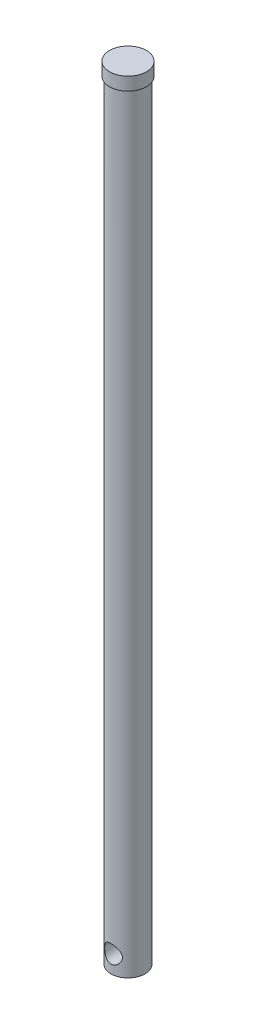
from build123d import *

# Parameters (mm, degrees)
SKETCH1_R                  = 4.953
BOSS_EXTRUDE1_DEPTH        = 228.6
BOSS_EXTRUDE2_START        = -3.81
SKETCH2_R                  = 5.3975
SKETCH2_R_2                = 4.953
BOSS_EXTRUDE2_DEPTH        = 3.81
F_6_0_204_DIAMETER_HOLE1_D = 5.1816


with BuildPart() as part:
    # Sketch1 → Boss-Extrude1 (new body)
    with BuildSketch(Plane(origin=(0, 0, 0), x_dir=(1, 0, 0), z_dir=(0, 1, 0))):
        with Locations(Location((0, 0, 0), (0, 0, 270))):
            Circle(SKETCH1_R)
    extrude(amount=BOSS_EXTRUDE1_DEPTH)

    # Sketch2 → Boss-Extrude2 (add)
    with BuildSketch(Plane(origin=(0, 228.6, 0), x_dir=(1, 0, 0), z_dir=(0, 1, 0)).offset(BOSS_EXTRUDE2_START)):
        with Locations(Location((0, 0, 0), (0, 0, 270))):
            Circle(SKETCH2_R)
        with Locations(Location((0, 0, 0), (0, 0, 270))):
            Circle(SKETCH2_R_2, mode=Mode.SUBTRACT)
    extrude(amount=BOSS_EXTRUDE2_DEPTH)

    # #6 (0.204) Diameter Hole1 (through all)
    with Locations(Plane.XY.offset(4.953)):
        with Locations((0, 5.08)):
            Hole(F_6_0_204_DIAMETER_HOLE1_D / 2)


solid = part.part
